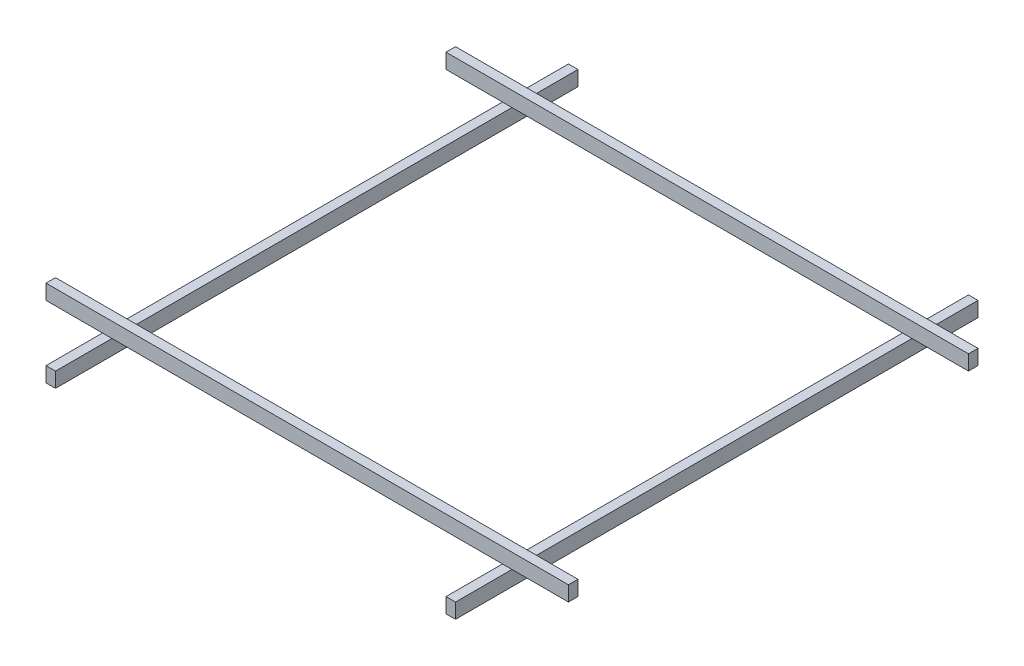
from build123d import *

# Parameters (mm, degrees)
SKETCH1_W              = 88.9
SKETCH1_H              = 139.7
PROFILES_4X6_1_DEPTH   = 4876.8
SKETCH1_ON_SEGMENT_2_W = 88.9
SKETCH1_ON_SEGMENT_2_H = 139.7
PROFILES_4X6_1_2_DEPTH = 4876.8
SKETCH1_ON_SEGMENT_3_W = 88.9
SKETCH1_ON_SEGMENT_3_H = 139.7
PROFILES_4X6_1_3_DEPTH = 4876.8
SKETCH1_ON_SEGMENT_4_W = 88.9
SKETCH1_ON_SEGMENT_4_H = 139.7
PROFILES_4X6_1_4_DEPTH = 4876.8


with BuildPart() as part:
    # Sketch1 → Profiles 4X6(1) (new body)
    with BuildSketch(Plane(origin=(266.7, 0, 0), x_dir=(-1, 0, 0), z_dir=(0, 0, -1))):
        Rectangle(SKETCH1_W, SKETCH1_H)
    extrude(amount=PROFILES_4X6_1_DEPTH)


with BuildPart() as body_2:
    # Sketch1 on segment 2 (carried to segment 2) → Profiles 4X6_1 2 (new body)
    with BuildSketch(Plane(origin=(4000.5, 0, 0), x_dir=(-1, 0, 0), z_dir=(0, 0, -1))):
        Rectangle(SKETCH1_ON_SEGMENT_2_W, SKETCH1_ON_SEGMENT_2_H)
    extrude(amount=PROFILES_4X6_1_2_DEPTH)


with BuildPart() as body_3:
    # Sketch1 on segment 3 (carried to segment 3) → Profiles 4X6_1 3 (new body)
    with BuildSketch(Plane(origin=(-304.8, 139.7, -4305.3), x_dir=(0, 0, -1), z_dir=(1, 0, 0))):
        Rectangle(SKETCH1_ON_SEGMENT_3_W, SKETCH1_ON_SEGMENT_3_H)
    extrude(amount=PROFILES_4X6_1_3_DEPTH)


with BuildPart() as body_4:
    # Sketch1 on segment 4 (carried to segment 4) → Profiles 4X6_1 4 (new body)
    with BuildSketch(Plane(origin=(4572, 139.7, -571.5), x_dir=(0, 0, 1), z_dir=(-1, 0, 0))):
        Rectangle(SKETCH1_ON_SEGMENT_4_W, SKETCH1_ON_SEGMENT_4_H)
    extrude(amount=PROFILES_4X6_1_4_DEPTH)


solid = Compound([part.part, body_2.part, body_3.part, body_4.part])
